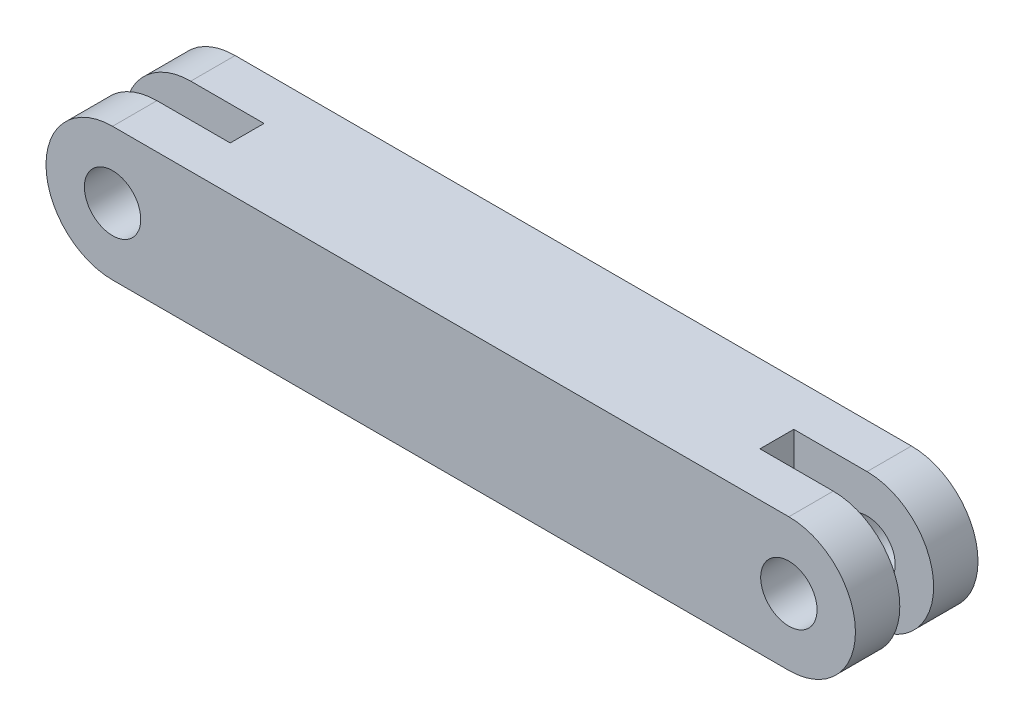
from build123d import *

# Parameters (mm, degrees)
SKETCH1_R           = 3.175
BOSS_EXTRUDE1_DEPTH = 5
SKETCH2_W           = 59.69
SKETCH2_H           = 15
BOSS_EXTRUDE2_DEPTH = 3.81
SKETCH5_R           = 3.175
BOSS_EXTRUDE3_DEPTH = 5


with BuildPart() as part:
    # Sketch1 → Boss-Extrude1 (new body)
    with BuildSketch(Plane.XY):
        with BuildLine():
            Line((-47.217391304, 7.923913043), (28.982608696, 7.923913043))
            ThreePointArc((28.982608696, 7.923913043), (36.482608696, 0.423913043), (28.982608696, -7.076086957))
            Line((28.982608696, -7.076086957), (-47.217391304, -7.076086957))
            ThreePointArc((-47.217391304, -7.076086957), (-54.717391304, 0.423913043), (-47.217391304, 7.923913043))
        make_face()
        with Locations((-47.217391304, 0.423913043)):
            Circle(SKETCH1_R, mode=Mode.SUBTRACT)
        with Locations((28.982608696, 0.423913043)):
            Circle(SKETCH1_R, mode=Mode.SUBTRACT)
    extrude(amount=BOSS_EXTRUDE1_DEPTH)

    # Sketch2 → Boss-Extrude2 (add)
    with BuildSketch(Plane.XY.offset(5)):
        with Locations((-9.117391304, 0.423913043)):
            Rectangle(SKETCH2_W, SKETCH2_H)
    extrude(amount=BOSS_EXTRUDE2_DEPTH)

    # Sketch5 → Boss-Extrude3 (add)
    with BuildSketch(Plane.XY.offset(8.81)):
        with BuildLine():
            Line((-47.217391304, 7.923913043), (28.982608696, 7.923913043))
            ThreePointArc((28.982608696, 7.923913043), (36.482608696, 0.423913043), (28.982608696, -7.076086957))
            Line((28.982608696, -7.076086957), (-47.217391304, -7.076086957))
            ThreePointArc((-47.217391304, -7.076086957), (-54.717391304, 0.423913043), (-47.217391304, 7.923913043))
        make_face()
        with Locations((-47.217391304, 0.423913043)):
            Circle(SKETCH5_R, mode=Mode.SUBTRACT)
        with Locations((28.982608696, 0.423913043)):
            Circle(SKETCH5_R, mode=Mode.SUBTRACT)
    extrude(amount=BOSS_EXTRUDE3_DEPTH)


solid = part.part
